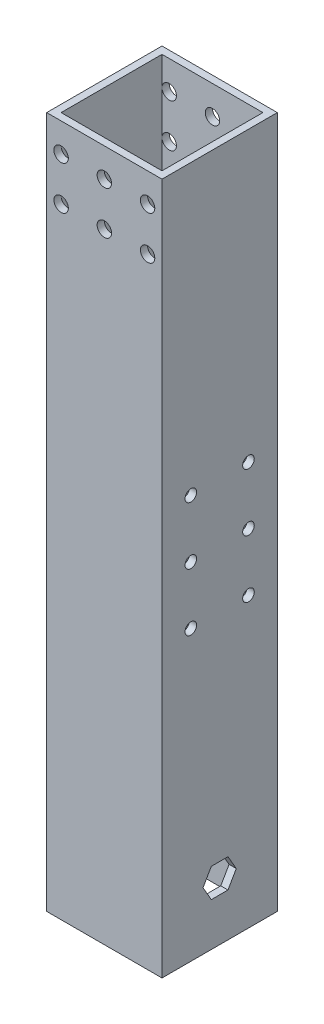
from build123d import *

# Parameters (mm, degrees)
SKETCH1_W            = 50.8
SKETCH1_H            = 50.8
SKETCH1_W_2          = 44.45
SKETCH1_H_2          = 44.45
BOSS_EXTRUDE1_DEPTH  = 304.8
SKETCH2_R            = 3.175
CUT_EXTRUDE1_DEPTH   = 101.6
LPATTERN1_COUNT      = 3
LPATTERN1_PITCH      = 19.05
LPATTERN1_COUNT_DIR2 = 2
LPATTERN1_PITCH_DIR2 = 19.05
CUT_EXTRUDE2_DEPTH   = 311.04651264
SKETCH4_R            = 2.5527
CUT_EXTRUDE3_DEPTH   = 50.8
LPATTERN2_COUNT      = 3
LPATTERN2_PITCH      = 25.4
LPATTERN2_COUNT_DIR2 = 2
LPATTERN2_PITCH_DIR2 = 25.4


with BuildPart() as part:
    # Sketch1 → Boss-Extrude1 (new body)
    with BuildSketch(Plane(origin=(0, 0, 0), x_dir=(1, 0, 0), z_dir=(0, 1, 0))):
        Rectangle(SKETCH1_W, SKETCH1_H)
        Rectangle(SKETCH1_W_2, SKETCH1_H_2, mode=Mode.SUBTRACT)
    extrude(amount=BOSS_EXTRUDE1_DEPTH)

    # Sketch2 → Cut-Extrude1 (cut)
    with BuildSketch(Plane.XY.offset(25.4)):
        with Locations((-19.05, 292.1)):
            Circle(SKETCH2_R)
    cut_extrude1 = extrude(amount=-CUT_EXTRUDE1_DEPTH, mode=Mode.SUBTRACT)

    # LPattern1: Cut-Extrude1 3 × 2
    with Locations(*[(i * LPATTERN1_PITCH, -j * LPATTERN1_PITCH_DIR2, 0) for i in range(LPATTERN1_COUNT) for j in range(LPATTERN1_COUNT_DIR2) if (i, j) != (0, 0)]):
        add(cut_extrude1, mode=Mode.SUBTRACT)

    # Sketch3 → Cut-Extrude2 (cut, through all)
    with BuildSketch(Plane(origin=(25.4, 0, 0), x_dir=(0, 0, -1), z_dir=(1, 0, 0))):
        Polygon((-3.666174209, 19.05), (3.666174209, 19.05), (7.332348419, 25.4), (3.666174209, 31.75), (-3.666174209, 31.75), (-7.332348419, 25.4), align=None)
    extrude(amount=-CUT_EXTRUDE2_DEPTH, mode=Mode.SUBTRACT)

    # Sketch4 → Cut-Extrude3 (cut)
    with BuildSketch(Plane(origin=(25.4, 0, 0), x_dir=(0, 0, -1), z_dir=(1, 0, 0))):
        with Locations((-12.7, 177.8)):
            Circle(SKETCH4_R)
    cut_extrude3 = extrude(amount=-CUT_EXTRUDE3_DEPTH, mode=Mode.SUBTRACT)

    # LPattern2: Cut-Extrude3 3 × 2
    with Locations(*[(0, -i * LPATTERN2_PITCH, -j * LPATTERN2_PITCH_DIR2) for i in range(LPATTERN2_COUNT) for j in range(LPATTERN2_COUNT_DIR2) if (i, j) != (0, 0)]):
        add(cut_extrude3, mode=Mode.SUBTRACT)


solid = part.part
